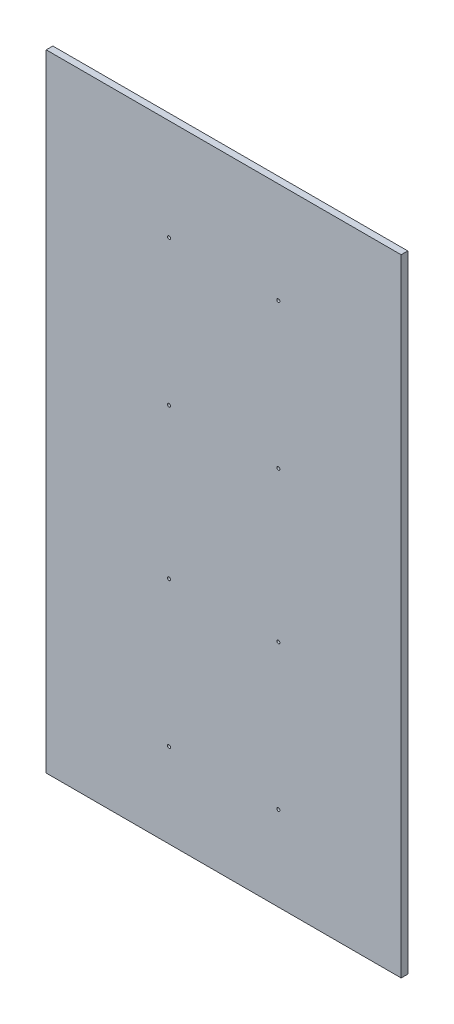
from build123d import *

# Parameters (mm, degrees)
SKETCH1_W        = 340
SKETCH1_H        = 600
SHEET_DEPTH      = 6.35
HOLES_DEPTH      = 690.666819921
HOLES_DEPTH_BACK = 690.666819921
SKETCH2_R        = 1.5


with BuildPart() as part:
    # Sketch1 → Sheet (new body)
    with BuildSketch(Plane.XY):
        with Locations((170, 300)):
            Rectangle(SKETCH1_W, SKETCH1_H)
    extrude(amount=SHEET_DEPTH)

    # Sketch2 → Holes (cut, two sides: drawn at the far end of the back side and taken through both)
    with BuildSketch(Plane.XY.offset(-HOLES_DEPTH_BACK)):
        with Locations((222.35, 80.9)):
            Circle(SKETCH2_R)
        with Locations((117.65, 80.9)):
            Circle(SKETCH2_R)
        with Locations((222.35, 220.033)):
            Circle(SKETCH2_R)
        with Locations((117.65, 220.033)):
            Circle(SKETCH2_R)
        with Locations((222.35, 363.967)):
            Circle(SKETCH2_R)
        with Locations((117.65, 363.967)):
            Circle(SKETCH2_R)
        with Locations((222.35, 503.1)):
            Circle(SKETCH2_R)
        with Locations((117.65, 503.1)):
            Circle(SKETCH2_R)
    extrude(amount=HOLES_DEPTH + HOLES_DEPTH_BACK, mode=Mode.SUBTRACT)


solid = part.part
